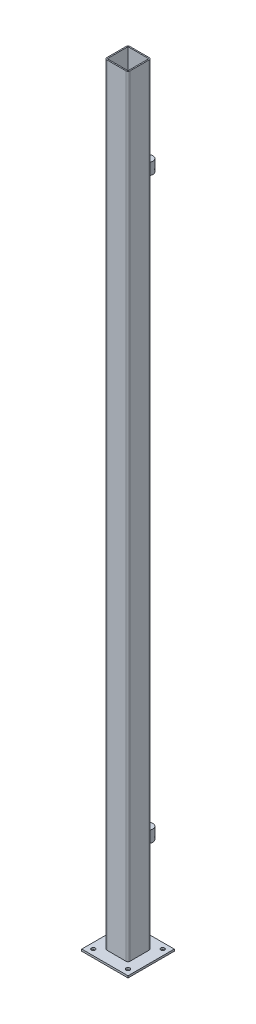
from build123d import *

# Parameters (mm, degrees)
SKETCH_1_W             = 120
SKETCH_1_H             = 120
EXTRUDE_1_DEPTH        = 5
SKETCH_2_W             = 60
SKETCH_2_H             = 60
SKETCH_2_W_2           = 54
SKETCH_2_H_2           = 54
EXTRUDE_2_DEPTH        = 2000
FILLET_1_R             = 5
SKETCH_3_R             = 5
CUT_EXTRUDE_1_DEPTH    = 2000
EXTRUDE_5_DEPTH        = 7.5
PATTERN_LINEAR_1_COUNT = 2
PATTERN_LINEAR_1_PITCH = 1500
SKETCH_7_R             = 12.5
EXTRUDE_6_DEPTH        = 30
SKETCH_8_R             = 4
EXTRUDE_7_DEPTH        = 35
PATTERN_LINEAR_2_COUNT = 2
PATTERN_LINEAR_2_PITCH = 1500


with BuildPart() as part:
    # 草图1 → 凸台-拉伸1 (new body)
    with BuildSketch(Plane(origin=(0, 0, 0), x_dir=(1, 0, 0), z_dir=(0, 1, 0))):
        Rectangle(SKETCH_1_W, SKETCH_1_H)
    extrude(amount=EXTRUDE_1_DEPTH)

    # 草图2 → 凸台-拉伸2 (add)
    with BuildSketch(Plane(origin=(0, 5, 0), x_dir=(1, 0, 0), z_dir=(0, 1, 0))):
        Rectangle(SKETCH_2_W, SKETCH_2_H)
        Rectangle(SKETCH_2_W_2, SKETCH_2_H_2, mode=Mode.SUBTRACT)
    extrude(amount=EXTRUDE_2_DEPTH)

    # 圆角1
    fillet_1_edges = [part.edges().sort_by_distance(p)[0] for p in [
        (-30, 1005, 30),
        (30, 1005, 30),
        (-30, 1005, -30),
        (30, 1005, -30),
    ]]
    fillet(fillet_1_edges, radius=FILLET_1_R)

    # 草图3 → 切除-拉伸1 (cut)
    with BuildSketch(Plane(origin=(0, 5, 0), x_dir=(1, 0, 0), z_dir=(0, 1, 0))):
        with Locations((-45, 45)):
            Circle(SKETCH_3_R)
        with Locations((45, 45)):
            Circle(SKETCH_3_R)
        with Locations((-45, -45)):
            Circle(SKETCH_3_R)
        with Locations((45, -45)):
            Circle(SKETCH_3_R)
    extrude(amount=-CUT_EXTRUDE_1_DEPTH, mode=Mode.SUBTRACT)

    # 草图6 → 凸台-拉伸5 (add, symmetric)
    with BuildSketch(Plane(origin=(0, 0, 0), x_dir=(0, 0, -1), z_dir=(1, 0, 0))):
        Polygon((30, 1785), (30, 1725), (40, 1725), (40, 1755), (33, 1755), (33, 1785), align=None)
    extrude_5 = extrude(amount=EXTRUDE_5_DEPTH, both=True)

    # 阵列(线性)1: 凸台-拉伸5 ×2
    with Locations(*[(0, -i * PATTERN_LINEAR_1_PITCH, 0) for i in range(1, PATTERN_LINEAR_1_COUNT)]):
        add(extrude_5)

    # 草图7 → 凸台-拉伸6 (add)
    with BuildSketch(Plane(origin=(0, 1755, 0), x_dir=(1, 0, 0), z_dir=(0, 1, 0))):
        with Locations((0, 52)):
            Circle(SKETCH_7_R)
    extrude_6 = extrude(amount=-EXTRUDE_6_DEPTH)

    # 草图8 → 凸台-拉伸7 (add)
    with BuildSketch(Plane(origin=(0, 1755, 0), x_dir=(1, 0, 0), z_dir=(0, 1, 0))):
        with Locations((0, 50)):
            Circle(SKETCH_8_R)
    extrude_7 = extrude(amount=EXTRUDE_7_DEPTH)

    # 阵列(线性)2: 凸台-拉伸6, 凸台-拉伸7 ×2
    with Locations(*[(0, -i * PATTERN_LINEAR_2_PITCH, 0) for i in range(1, PATTERN_LINEAR_2_COUNT)]):
        add(extrude_6)
        add(extrude_7)


solid = part.part
